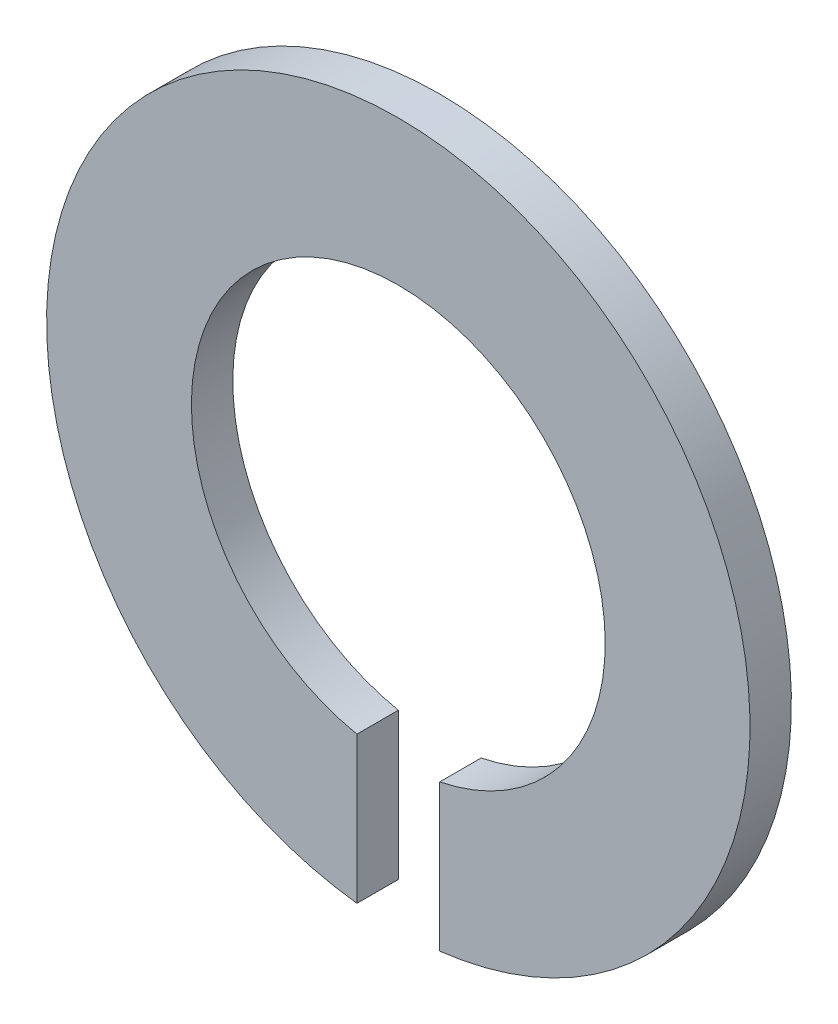
from build123d import *

# Parameters (mm, degrees)
BOSS_EXTRU_1_DEPTH = 0.5


with BuildPart() as part:
    # Esquisse2 → Boss.-Extru.1 (new body)
    with BuildSketch(Plane.XY):
        with BuildLine():
            Line((0.5, -4.220485754), (0.5, -2.449489743))
            ThreePointArc((0.5, -2.449489743), (0, 2.5), (-0.5, -2.449489743))
            Line((-0.5, -2.449489743), (-0.5, -4.220485754))
            ThreePointArc((-0.5, -4.220485754), (0, 4.25), (0.5, -4.220485754))
        make_face()
    extrude(amount=BOSS_EXTRU_1_DEPTH)


solid = part.part
